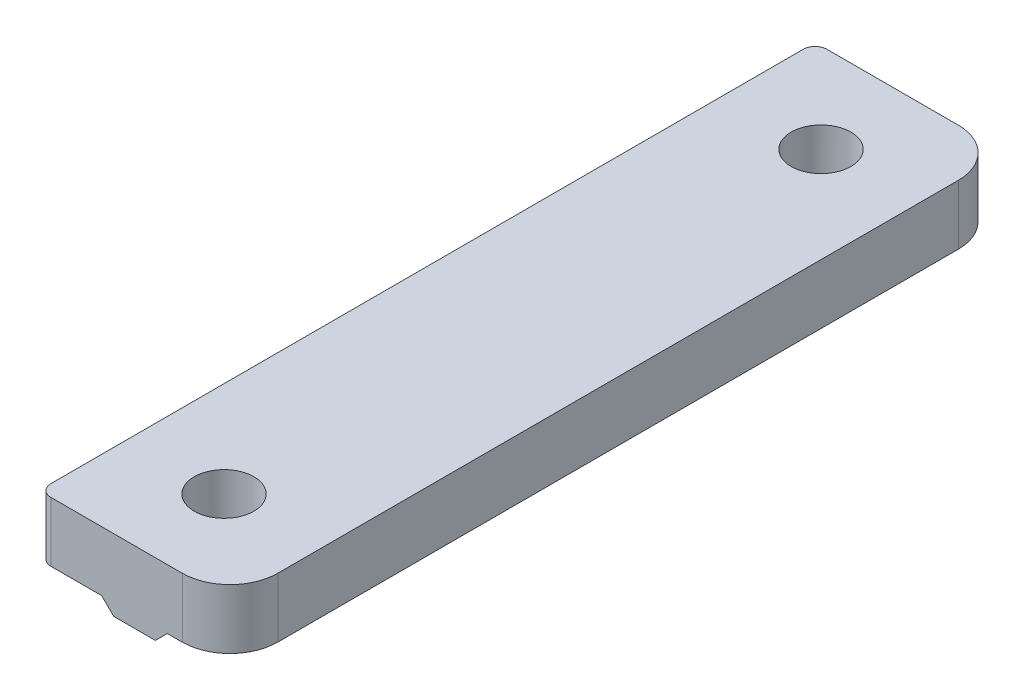
from build123d import *

# Parameters (mm, degrees)
ESQUISSE1_W             = 16
ESQUISSE1_H             = 5
BOSS_EXTRU_1_DEPTH      = 65
BOSS_EXTRU_3_DEPTH      = 65
ESQUISSE2_R             = 2.5
ENL_V_MAT_EXTRU_1_DEPTH = 66.76473219
CONG_1_R                = 4
CONG_2_R                = 1


with BuildPart() as part:
    # Esquisse1 → Boss.-Extru.1 (new body)
    with BuildSketch(Plane.XY):
        Rectangle(ESQUISSE1_W, ESQUISSE1_H)
    extrude(amount=BOSS_EXTRU_1_DEPTH)

    # Esquisse4 → Boss.-Extru.3 (add)
    with BuildSketch(Plane.XY.offset(65)):
        Polygon((-1.75, -3.5), (1.75, -3.5), (2.75, -2.5), (-2.75, -2.5), align=None)
    extrude(amount=-BOSS_EXTRU_3_DEPTH)

    # Esquisse2 → Enlèv. mat.-Extru.1 (cut, through all)
    with BuildSketch(Plane(origin=(0, 2.5, 0), x_dir=(1, 0, 0), z_dir=(0, 1, 0))):
        with Locations(Location((0, -7.5, 0), (0, 0, 270))):
            Circle(ESQUISSE2_R)
        with Locations(Location((0, -57.5, 0), (0, 0, 225.572995999))):
            Circle(ESQUISSE2_R)
    extrude(amount=-ENL_V_MAT_EXTRU_1_DEPTH, mode=Mode.SUBTRACT)

    # Congé1
    cong_1_edges = [part.edges().sort_by_distance(p)[0] for p in [
        (8, 0, 65),
        (8, 0, 0),
    ]]
    fillet(cong_1_edges, radius=CONG_1_R)

    # Congé2
    cong_2_edges = [part.edges().sort_by_distance(p)[0] for p in [
        (-8, 0, 65),
        (-8, 0, 0),
    ]]
    fillet(cong_2_edges, radius=CONG_2_R)


solid = part.part
